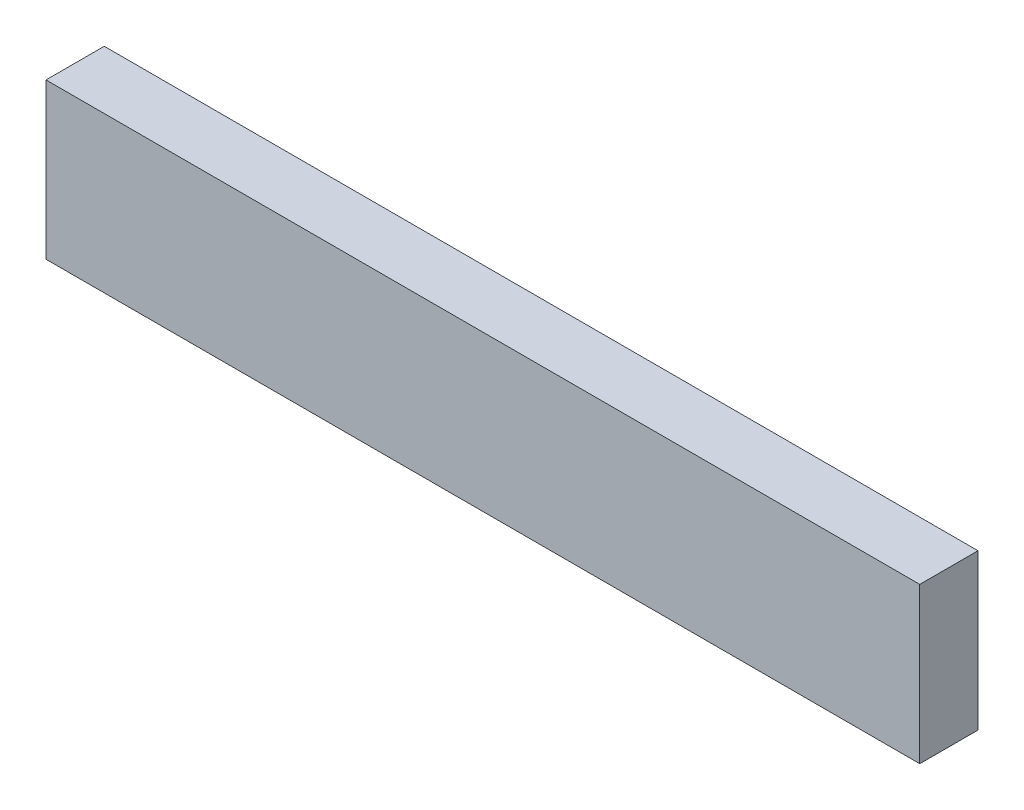
from build123d import *

# Parameters (mm, degrees)
SKETCH1_W           = 45
SKETCH1_H           = 8
BOSS_EXTRUDE1_DEPTH = 3


with BuildPart() as part:
    # Sketch1 → Boss-Extrude1 (new body)
    with BuildSketch(Plane.XY):
        with Locations((22.5, 4)):
            Rectangle(SKETCH1_W, SKETCH1_H)
    extrude(amount=BOSS_EXTRUDE1_DEPTH)


solid = part.part
